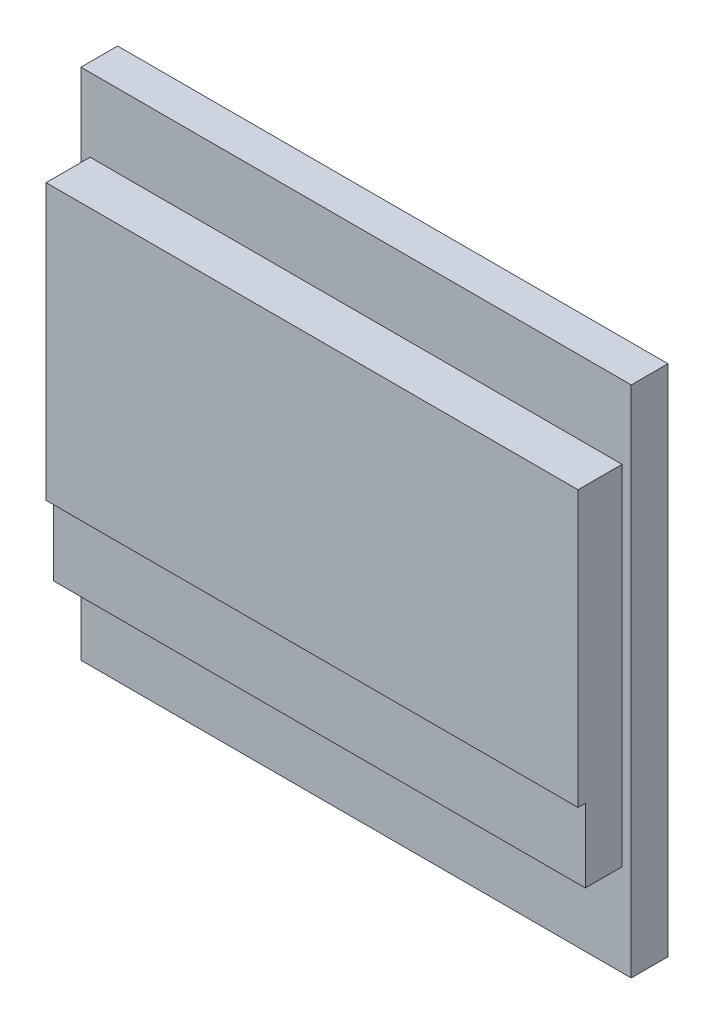
from build123d import *

# Parameters (mm, degrees)
SKETCH_1_W      = 30
SKETCH_1_H      = 28
EXTRUDE_1_DEPTH = 2
SKETCH_2_W      = 29
SKETCH_2_H      = 19
EXTRUDE_2_DEPTH = 2
SKETCH_3_W      = 29
SKETCH_3_H      = 15
EXTRUDE_3_DEPTH = 2.4


with BuildPart() as part:
    # 草图1 → 凸台-拉伸1 (new body)
    with BuildSketch(Plane.XY):
        Rectangle(SKETCH_1_W, SKETCH_1_H)
    extrude(amount=-EXTRUDE_1_DEPTH)

    # 草图2 → 凸台-拉伸2 (add)
    with BuildSketch(Plane.XY):
        with Locations((0, 0.5)):
            Rectangle(SKETCH_2_W, SKETCH_2_H)
    extrude(amount=EXTRUDE_2_DEPTH)

    # 草图3 → 凸台-拉伸3 (add)
    with BuildSketch(Plane.XY):
        with Locations((0, 2.5)):
            Rectangle(SKETCH_3_W, SKETCH_3_H)
    extrude(amount=EXTRUDE_3_DEPTH)


solid = part.part
